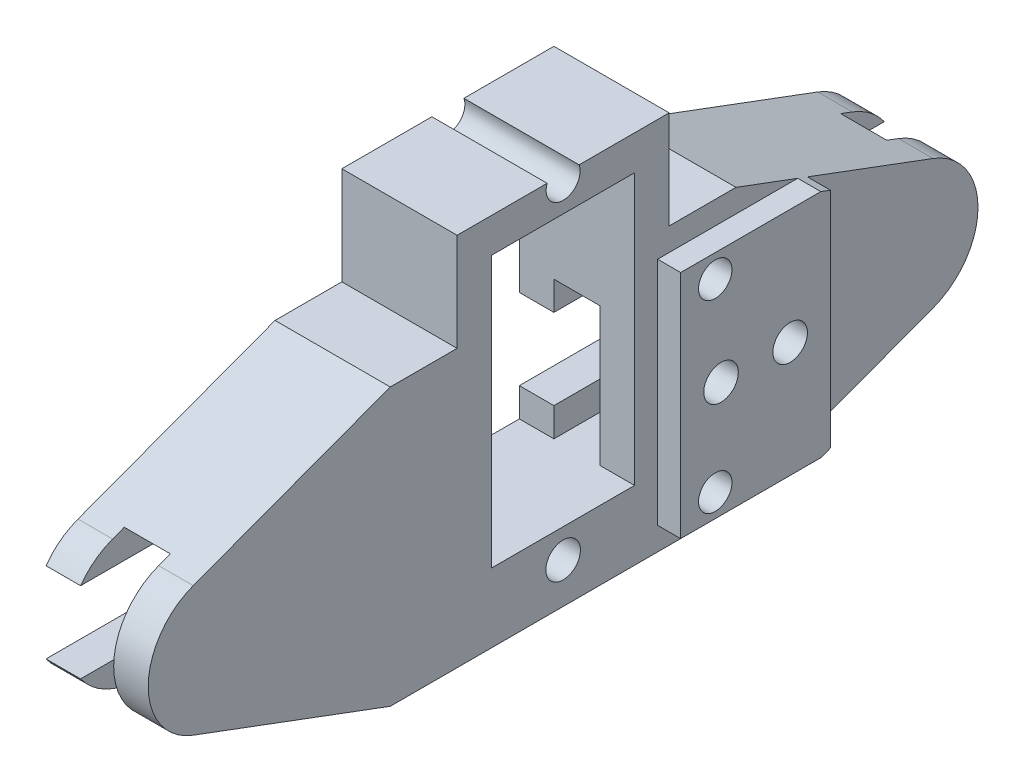
from build123d import *

# Parameters (mm, degrees)
EXTRUDE_1_DEPTH          = 10
CUT_EXTRUDE_1_DEPTH      = 74.674961826
CUT_EXTRUDE_1_DEPTH_BACK = 74.674961826
SKETCH_3_W               = 12.4
SKETCH_3_H               = 18
CUT_EXTRUDE_4_DEPTH      = 10
EXTRUDE_3_DEPTH          = 10
SKETCH_5_R               = 1.4
CUT_EXTRUDE_5_DEPTH      = 10
SKETCH_6_R               = 1.475
SKETCH_6_R_2             = 1.5
CUT_EXTRUDE_6_DEPTH      = 10
EXTRUDE_4_DEPTH          = 2
SKETCH_8_R               = 1.5
CUT_EXTRUDE_8_DEPTH      = 44.130615576
SKETCH_9_R               = 2.75
CUT_EXTRUDE_9_DEPTH      = 2
SKETCH_10_R              = 1.45
CUT_EXTRUDE_10_DEPTH     = 5


with BuildPart() as part:
    # 草图1 → 凸台-拉伸1 (new body)
    with BuildSketch(Plane(origin=(0, 0, 0), x_dir=(0, 0, -1), z_dir=(1, 0, 0))):
        with BuildLine():
            Line((-32.097226847, 5.621533559), (-15, 12))
            Line((-15, 12), (15, 12))
            Line((15, 12), (32.097226847, 5.621533559))
            ThreePointArc((32.097226847, 5.621533559), (36, 0), (32.097226847, -5.621533559))
            Line((32.097226847, -5.621533559), (15, -12))
            Line((15, -12), (-15, -12))
            Line((-15, -12), (-32.097226847, -5.621533559))
            ThreePointArc((-32.097226847, -5.621533559), (-36, 0), (-32.097226847, 5.621533559))
        make_face()
    extrude(amount=EXTRUDE_1_DEPTH)

    # 草图2 → 切除-拉伸1 (cut, two sides: drawn at the far end of the back side and taken through both)
    with BuildSketch(Plane.XY.offset(36).offset(-CUT_EXTRUDE_1_DEPTH_BACK)):
        Polygon((0, -3.5), (3, -3.5), (3, -6), (7, -6), (7, 6), (3, 6), (3, 3.5), (0, 3.5), align=None)
    extrude(amount=CUT_EXTRUDE_1_DEPTH + CUT_EXTRUDE_1_DEPTH_BACK, mode=Mode.SUBTRACT)

    # 草图3 → 切除-拉伸4 (cut)
    with BuildSketch(Plane(origin=(10, 0, 0), x_dir=(0, 0, -1), z_dir=(1, 0, 0))):
        with Locations((0, 3)):
            Rectangle(SKETCH_3_W, SKETCH_3_H)
    extrude(amount=-CUT_EXTRUDE_4_DEPTH, mode=Mode.SUBTRACT)

    # 草图4 → 凸台-拉伸3 (add)
    with BuildSketch(Plane(origin=(10, 0, 0), x_dir=(0, 0, -1), z_dir=(1, 0, 0))):
        Polygon((-6.2, 17.5), (6.2, 17.5), (6.2, 12), (9.2, 12), (9.2, 20.5), (-9.2, 20.5), (-9.2, 12), (-6.2, 12), align=None)
    extrude(amount=-EXTRUDE_3_DEPTH)

    # 草图5 → 切除-拉伸5 (cut)
    with BuildSketch(Plane(origin=(10, 0, 0), x_dir=(0, 0, -1), z_dir=(1, 0, 0))):
        with Locations((0, -8.5)):
            Circle(SKETCH_5_R)
        with Locations((0, 20)):
            Circle(SKETCH_5_R)
    extrude(amount=-CUT_EXTRUDE_5_DEPTH, mode=Mode.SUBTRACT)

    # 草图6 → 切除-拉伸6 (cut)
    with BuildSketch(Plane(origin=(10, 0, 0), x_dir=(0, 0, -1), z_dir=(1, 0, 0))):
        with Locations((0, 20)):
            Circle(SKETCH_6_R)
        with Locations((0, -8.5)):
            Circle(SKETCH_6_R_2)
    extrude(amount=-CUT_EXTRUDE_6_DEPTH, mode=Mode.SUBTRACT)

    # 草图7 → 凸台-拉伸4 (add)
    with BuildSketch(Plane(origin=(10, 0, 0), x_dir=(0, 0, -1), z_dir=(1, 0, 0))):
        Polygon((8.2, -10), (20.360920843, -10), (21.2, -9.686964542), (21.2, 9.686964542), (20.360920843, 10), (8.2, 10), align=None)
    extrude(amount=EXTRUDE_4_DEPTH)

    # 草图8 → 切除-拉伸8 (cut, through all)
    with BuildSketch(Plane(origin=(12, 0, 0), x_dir=(0, 0, -1), z_dir=(1, 0, 0))):
        with Locations((11.7, 0)):
            Circle(SKETCH_8_R)
        with Locations((17.7, 0)):
            Circle(SKETCH_8_R)
    extrude(amount=-CUT_EXTRUDE_8_DEPTH, mode=Mode.SUBTRACT)

    # 草图9 → 切除-拉伸9 (cut)
    with BuildSketch(Plane.ZY.offset(-7)):
        with Locations(Location((-17.7, 0, 0), (0, 0, 270))):
            Circle(SKETCH_9_R)
        with Locations(Location((-11.7, 0, 0), (0, 0, 270))):
            Circle(SKETCH_9_R)
    extrude(amount=-CUT_EXTRUDE_9_DEPTH, mode=Mode.SUBTRACT)

    # 草图10 → 切除-拉伸10 (cut)
    with BuildSketch(Plane(origin=(12, 0, 0), x_dir=(0, 0, -1), z_dir=(1, 0, 0))):
        with Locations((11.2, 8)):
            Circle(SKETCH_10_R)
        with Locations((11.2, -8)):
            Circle(SKETCH_10_R)
    extrude(amount=-CUT_EXTRUDE_10_DEPTH, mode=Mode.SUBTRACT)


solid = part.part
